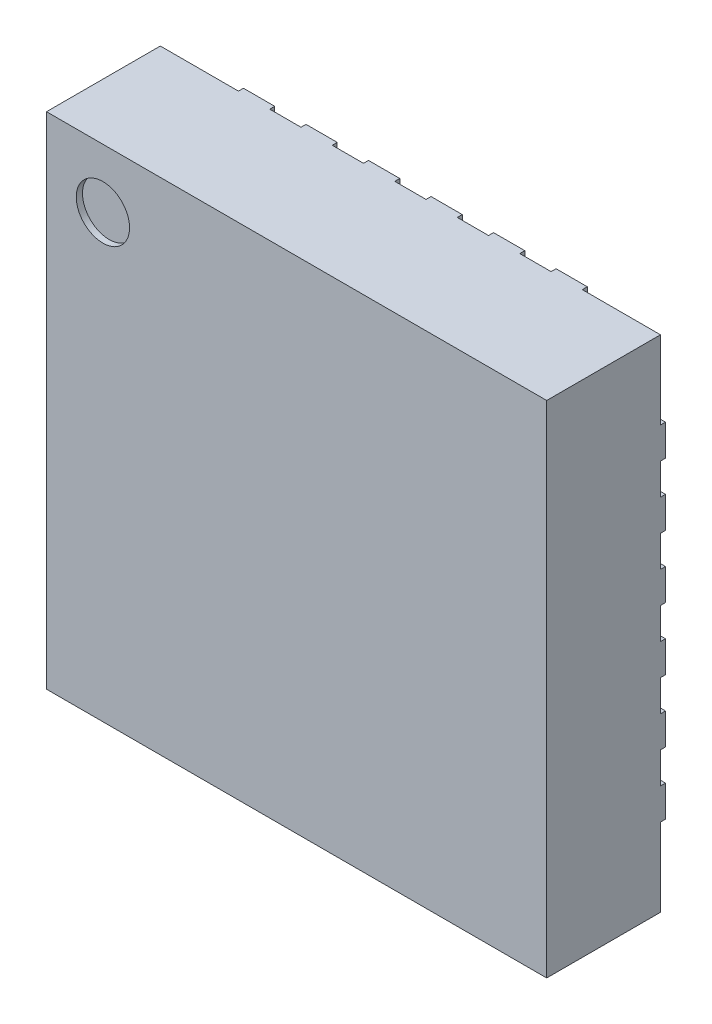
from build123d import *

# Parameters (mm, degrees)
SKETCH1_W                 = 4
SKETCH1_H                 = 4
BOSS_EXTRUDE1_DEPTH       = 0.91
BOSS_EXTRUDE2_DEPTH       = 0.04
BOSS_EXTRUDE3_DEPTH       = 0.04
LPATTERN1_COUNT           = 6
LPATTERN1_PITCH           = 0.5
CIRPATTERN1_COUNT         = 4
CIRPATTERN1_COPY_1_DEPTH  = 0.04
CIRPATTERN1_COPY_2_DEPTH  = 0.04
CIRPATTERN1_COPY_3_DEPTH  = 0.04
CIRPATTERN1_COPY_4_DEPTH  = 0.04
CIRPATTERN1_COPY_5_DEPTH  = 0.04
CIRPATTERN1_COPY_6_DEPTH  = 0.04
CIRPATTERN1_COPY_7_DEPTH  = 0.04
CIRPATTERN1_COPY_8_DEPTH  = 0.04
CIRPATTERN1_COPY_9_DEPTH  = 0.04
CIRPATTERN1_COPY_10_DEPTH = 0.04
CIRPATTERN1_COPY_11_DEPTH = 0.04
CIRPATTERN1_COPY_12_DEPTH = 0.04
CIRPATTERN1_COPY_13_DEPTH = 0.04
CIRPATTERN1_COPY_14_DEPTH = 0.04
CIRPATTERN1_COPY_15_DEPTH = 0.04
SKETCH4_R                 = 0.213174932
CUT_EXTRUDE1_DEPTH        = 0.05


with BuildPart() as part:
    # Sketch1 → Boss-Extrude1 (new body)
    with BuildSketch(Plane.XY):
        Rectangle(SKETCH1_W, SKETCH1_H)
    extrude(amount=BOSS_EXTRUDE1_DEPTH)

    # Sketch2 → Boss-Extrude2 (add)
    with BuildSketch(Plane(origin=(0, 0, 0), x_dir=(-1, 0, 0), z_dir=(0, 0, -1))):
        with BuildLine():
            Line((-1.2, -1.3), (1.2, -1.3))
            ThreePointArc((1.2, -1.3), (1.270710678, -1.270710678), (1.3, -1.2))
            Line((1.3, -1.2), (1.3, 1.2))
            ThreePointArc((1.3, 1.2), (1.270710678, 1.270710678), (1.2, 1.3))
            Line((1.2, 1.3), (-1.2, 1.3))
            ThreePointArc((-1.2, 1.3), (-1.270710678, 1.270710678), (-1.3, 1.2))
            Line((-1.3, 1.2), (-1.3, -1.2))
            ThreePointArc((-1.3, -1.2), (-1.270710678, -1.270710678), (-1.2, -1.3))
        make_face()
    extrude(amount=BOSS_EXTRUDE2_DEPTH)

    # Sketch3 → Boss-Extrude3 (add)
    with BuildSketch(Plane(origin=(0, 0, 0), x_dir=(-1, 0, 0), z_dir=(0, 0, -1))):
        with BuildLine():
            Line((-2, 1.125), (-1.625, 1.125))
            ThreePointArc((-1.625, 1.125), (-1.5, 1.25), (-1.625, 1.375))
            Line((-1.625, 1.375), (-2, 1.375))
            Line((-2, 1.375), (-2, 1.125))
        make_face()
    boss_extrude3 = extrude(amount=BOSS_EXTRUDE3_DEPTH)

    # LPattern1: Boss-Extrude3 ×6
    with Locations(*[(0, -i * LPATTERN1_PITCH, 0) for i in range(1, LPATTERN1_COUNT)]):
        add(boss_extrude3)

    # CirPattern1: Boss-Extrude3 ×4 about axis
    cirpattern1_axis = Axis((0, 0, 0), (0, 0, 1))
    for i in range(1, CIRPATTERN1_COUNT):
        add(boss_extrude3.rotate(cirpattern1_axis, i * 360 / CIRPATTERN1_COUNT))

    # CirPattern1 copy 1 sketch → CirPattern1 copy 1 (add)
    with BuildSketch(Plane(origin=(0.5, 0, 0), x_dir=(0, -1, 0), z_dir=(0, 0, -1))):
        with BuildLine():
            Line((-2, 1.125), (-1.625, 1.125))
            ThreePointArc((-1.625, 1.125), (-1.5, 1.25), (-1.625, 1.375))
            Line((-1.625, 1.375), (-2, 1.375))
            Line((-2, 1.375), (-2, 1.125))
        make_face()
    extrude(amount=CIRPATTERN1_COPY_1_DEPTH)

    # CirPattern1 copy 2 sketch → CirPattern1 copy 2 (add)
    with BuildSketch(Plane(origin=(0, 0.5, 0), x_dir=(1, 0, 0), z_dir=(0, 0, -1))):
        with BuildLine():
            Line((-2, 1.125), (-1.625, 1.125))
            ThreePointArc((-1.625, 1.125), (-1.5, 1.25), (-1.625, 1.375))
            Line((-1.625, 1.375), (-2, 1.375))
            Line((-2, 1.375), (-2, 1.125))
        make_face()
    extrude(amount=CIRPATTERN1_COPY_2_DEPTH)

    # CirPattern1 copy 3 sketch → CirPattern1 copy 3 (add)
    with BuildSketch(Plane(origin=(-0.5, 0, 0), x_dir=(0, 1, 0), z_dir=(0, 0, -1))):
        with BuildLine():
            Line((-2, 1.125), (-1.625, 1.125))
            ThreePointArc((-1.625, 1.125), (-1.5, 1.25), (-1.625, 1.375))
            Line((-1.625, 1.375), (-2, 1.375))
            Line((-2, 1.375), (-2, 1.125))
        make_face()
    extrude(amount=CIRPATTERN1_COPY_3_DEPTH)

    # CirPattern1 copy 4 sketch → CirPattern1 copy 4 (add)
    with BuildSketch(Plane(origin=(1, 0, 0), x_dir=(0, -1, 0), z_dir=(0, 0, -1))):
        with BuildLine():
            Line((-2, 1.125), (-1.625, 1.125))
            ThreePointArc((-1.625, 1.125), (-1.5, 1.25), (-1.625, 1.375))
            Line((-1.625, 1.375), (-2, 1.375))
            Line((-2, 1.375), (-2, 1.125))
        make_face()
    extrude(amount=CIRPATTERN1_COPY_4_DEPTH)

    # CirPattern1 copy 5 sketch → CirPattern1 copy 5 (add)
    with BuildSketch(Plane(origin=(0, 1, 0), x_dir=(1, 0, 0), z_dir=(0, 0, -1))):
        with BuildLine():
            Line((-2, 1.125), (-1.625, 1.125))
            ThreePointArc((-1.625, 1.125), (-1.5, 1.25), (-1.625, 1.375))
            Line((-1.625, 1.375), (-2, 1.375))
            Line((-2, 1.375), (-2, 1.125))
        make_face()
    extrude(amount=CIRPATTERN1_COPY_5_DEPTH)

    # CirPattern1 copy 6 sketch → CirPattern1 copy 6 (add)
    with BuildSketch(Plane(origin=(-1, 0, 0), x_dir=(0, 1, 0), z_dir=(0, 0, -1))):
        with BuildLine():
            Line((-2, 1.125), (-1.625, 1.125))
            ThreePointArc((-1.625, 1.125), (-1.5, 1.25), (-1.625, 1.375))
            Line((-1.625, 1.375), (-2, 1.375))
            Line((-2, 1.375), (-2, 1.125))
        make_face()
    extrude(amount=CIRPATTERN1_COPY_6_DEPTH)

    # CirPattern1 copy 7 sketch → CirPattern1 copy 7 (add)
    with BuildSketch(Plane(origin=(1.5, 0, 0), x_dir=(0, -1, 0), z_dir=(0, 0, -1))):
        with BuildLine():
            Line((-2, 1.125), (-1.625, 1.125))
            ThreePointArc((-1.625, 1.125), (-1.5, 1.25), (-1.625, 1.375))
            Line((-1.625, 1.375), (-2, 1.375))
            Line((-2, 1.375), (-2, 1.125))
        make_face()
    extrude(amount=CIRPATTERN1_COPY_7_DEPTH)

    # CirPattern1 copy 8 sketch → CirPattern1 copy 8 (add)
    with BuildSketch(Plane(origin=(0, 1.5, 0), x_dir=(1, 0, 0), z_dir=(0, 0, -1))):
        with BuildLine():
            Line((-2, 1.125), (-1.625, 1.125))
            ThreePointArc((-1.625, 1.125), (-1.5, 1.25), (-1.625, 1.375))
            Line((-1.625, 1.375), (-2, 1.375))
            Line((-2, 1.375), (-2, 1.125))
        make_face()
    extrude(amount=CIRPATTERN1_COPY_8_DEPTH)

    # CirPattern1 copy 9 sketch → CirPattern1 copy 9 (add)
    with BuildSketch(Plane(origin=(-1.5, 0, 0), x_dir=(0, 1, 0), z_dir=(0, 0, -1))):
        with BuildLine():
            Line((-2, 1.125), (-1.625, 1.125))
            ThreePointArc((-1.625, 1.125), (-1.5, 1.25), (-1.625, 1.375))
            Line((-1.625, 1.375), (-2, 1.375))
            Line((-2, 1.375), (-2, 1.125))
        make_face()
    extrude(amount=CIRPATTERN1_COPY_9_DEPTH)

    # CirPattern1 copy 10 sketch → CirPattern1 copy 10 (add)
    with BuildSketch(Plane(origin=(2, 0, 0), x_dir=(0, -1, 0), z_dir=(0, 0, -1))):
        with BuildLine():
            Line((-2, 1.125), (-1.625, 1.125))
            ThreePointArc((-1.625, 1.125), (-1.5, 1.25), (-1.625, 1.375))
            Line((-1.625, 1.375), (-2, 1.375))
            Line((-2, 1.375), (-2, 1.125))
        make_face()
    extrude(amount=CIRPATTERN1_COPY_10_DEPTH)

    # CirPattern1 copy 11 sketch → CirPattern1 copy 11 (add)
    with BuildSketch(Plane(origin=(0, 2, 0), x_dir=(1, 0, 0), z_dir=(0, 0, -1))):
        with BuildLine():
            Line((-2, 1.125), (-1.625, 1.125))
            ThreePointArc((-1.625, 1.125), (-1.5, 1.25), (-1.625, 1.375))
            Line((-1.625, 1.375), (-2, 1.375))
            Line((-2, 1.375), (-2, 1.125))
        make_face()
    extrude(amount=CIRPATTERN1_COPY_11_DEPTH)

    # CirPattern1 copy 12 sketch → CirPattern1 copy 12 (add)
    with BuildSketch(Plane(origin=(-2, 0, 0), x_dir=(0, 1, 0), z_dir=(0, 0, -1))):
        with BuildLine():
            Line((-2, 1.125), (-1.625, 1.125))
            ThreePointArc((-1.625, 1.125), (-1.5, 1.25), (-1.625, 1.375))
            Line((-1.625, 1.375), (-2, 1.375))
            Line((-2, 1.375), (-2, 1.125))
        make_face()
    extrude(amount=CIRPATTERN1_COPY_12_DEPTH)

    # CirPattern1 copy 13 sketch → CirPattern1 copy 13 (add)
    with BuildSketch(Plane(origin=(2.5, 0, 0), x_dir=(0, -1, 0), z_dir=(0, 0, -1))):
        with BuildLine():
            Line((-2, 1.125), (-1.625, 1.125))
            ThreePointArc((-1.625, 1.125), (-1.5, 1.25), (-1.625, 1.375))
            Line((-1.625, 1.375), (-2, 1.375))
            Line((-2, 1.375), (-2, 1.125))
        make_face()
    extrude(amount=CIRPATTERN1_COPY_13_DEPTH)

    # CirPattern1 copy 14 sketch → CirPattern1 copy 14 (add)
    with BuildSketch(Plane(origin=(0, 2.5, 0), x_dir=(1, 0, 0), z_dir=(0, 0, -1))):
        with BuildLine():
            Line((-2, 1.125), (-1.625, 1.125))
            ThreePointArc((-1.625, 1.125), (-1.5, 1.25), (-1.625, 1.375))
            Line((-1.625, 1.375), (-2, 1.375))
            Line((-2, 1.375), (-2, 1.125))
        make_face()
    extrude(amount=CIRPATTERN1_COPY_14_DEPTH)

    # CirPattern1 copy 15 sketch → CirPattern1 copy 15 (add)
    with BuildSketch(Plane(origin=(-2.5, 0, 0), x_dir=(0, 1, 0), z_dir=(0, 0, -1))):
        with BuildLine():
            Line((-2, 1.125), (-1.625, 1.125))
            ThreePointArc((-1.625, 1.125), (-1.5, 1.25), (-1.625, 1.375))
            Line((-1.625, 1.375), (-2, 1.375))
            Line((-2, 1.375), (-2, 1.125))
        make_face()
    extrude(amount=CIRPATTERN1_COPY_15_DEPTH)

    # Sketch4 → Cut-Extrude1 (cut)
    with BuildSketch(Plane.XY.offset(0.91)):
        with Locations((-1.549189325, 1.528334853)):
            Circle(SKETCH4_R)
    extrude(amount=-CUT_EXTRUDE1_DEPTH, mode=Mode.SUBTRACT)


solid = part.part
